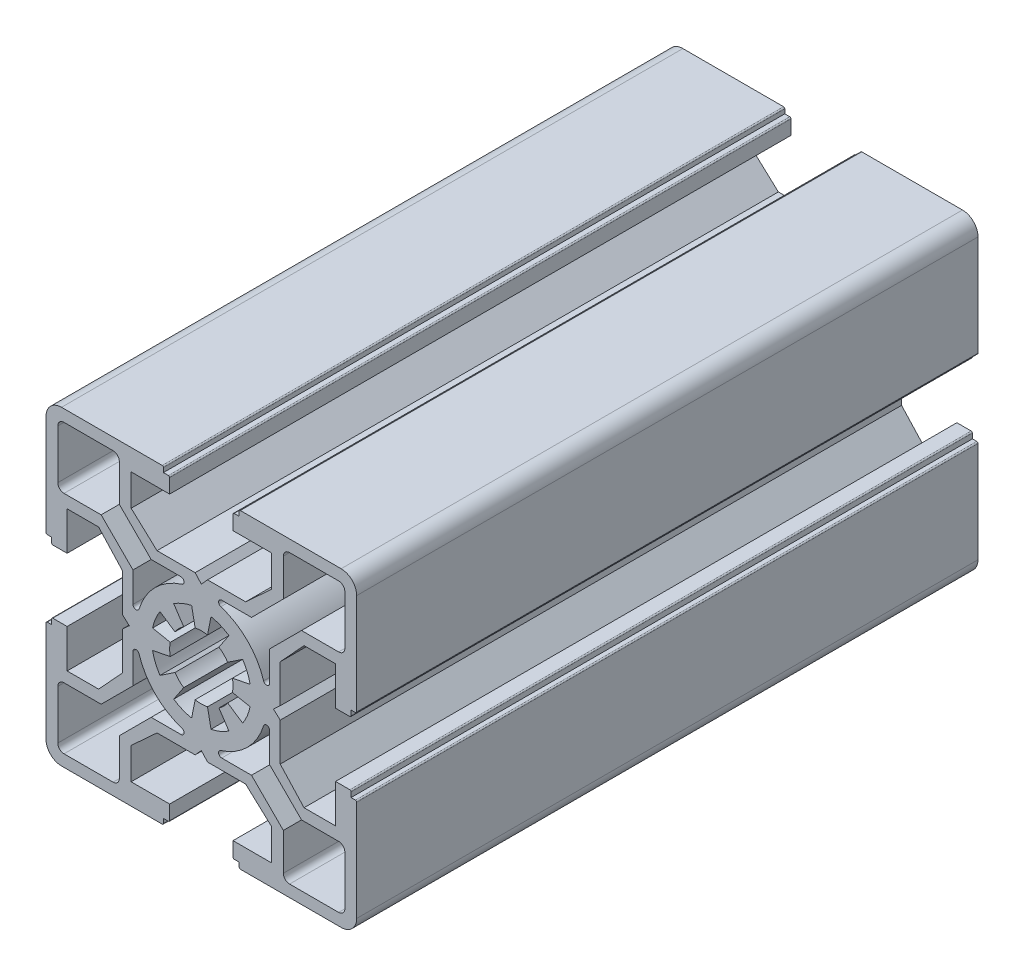
from build123d import *

# Parameters (mm, degrees)
EXTRUDE_1_DEPTH = 100


with BuildPart() as part:
    # 草图1 → 凸台-拉伸1 (new body)
    with BuildSketch(Plane.XY):
        with BuildLine():
            Line((-6.3, 25), (-22.5, 25))
            ThreePointArc((-22.5, 25), (-24.267766953, 24.267766953), (-25, 22.5))
            Line((-25, 22.5), (-25, 6.3))
            ThreePointArc((-25, 6.3), (-24.941421356, 6.158578644), (-24.8, 6.1))
            Line((-24.8, 6.1), (-24.1, 6.1))
            Line((-24.1, 6.1), (-24.1, 5.3))
            ThreePointArc((-24.1, 5.3), (-24.041421356, 5.158578644), (-23.9, 5.1))
            Line((-23.9, 5.1), (-21.6, 5.1))
            Line((-21.6, 5.1), (-21.6, 11.3))
            Line((-21.6, 11.3), (-16.53, 11.3))
            Line((-16.53, 11.3), (-12.7, 7.130151519))
            Line((-12.7, 7.130151519), (-12.7, 1))
            Line((-12.7, 1), (-11.6, 0))
            Line((-11.6, 0), (-12.7, -1))
            Line((-12.7, -1), (-12.7, -7.130151519))
            Line((-12.7, -7.130151519), (-16.53, -11.3))
            Line((-16.53, -11.3), (-21.6, -11.3))
            Line((-21.6, -11.3), (-21.6, -5.1))
            Line((-21.6, -5.1), (-23.9, -5.1))
            ThreePointArc((-23.9, -5.1), (-24.041421356, -5.158578644), (-24.1, -5.3))
            Line((-24.1, -5.3), (-24.1, -6.1))
            Line((-24.1, -6.1), (-24.8, -6.1))
            ThreePointArc((-24.8, -6.1), (-24.941421356, -6.158578644), (-25, -6.3))
            Line((-25, -6.3), (-25, -22.5))
            ThreePointArc((-25, -22.5), (-24.267766953, -24.267766953), (-22.5, -25))
            Line((-22.5, -25), (-6.3, -25))
            ThreePointArc((-6.3, -25), (-6.158578644, -24.941421356), (-6.1, -24.8))
            Line((-6.1, -24.8), (-6.1, -24.1))
            Line((-6.1, -24.1), (-5.3, -24.1))
            ThreePointArc((-5.3, -24.1), (-5.158578644, -24.041421356), (-5.1, -23.9))
            Line((-5.1, -23.9), (-5.1, -21.6))
            Line((-5.1, -21.6), (-11.3, -21.6))
            Line((-11.3, -21.6), (-11.3, -16.53))
            Line((-11.3, -16.53), (-7.130151519, -12.7))
            Line((-7.130151519, -12.7), (-1, -12.7))
            Line((-1, -12.7), (0, -11.6))
            Line((0, -11.6), (1, -12.7))
            Line((1, -12.7), (7.130151519, -12.7))
            Line((7.130151519, -12.7), (11.3, -16.53))
            Line((11.3, -16.53), (11.3, -21.6))
            Line((11.3, -21.6), (5.1, -21.6))
            Line((5.1, -21.6), (5.1, -23.9))
            ThreePointArc((5.1, -23.9), (5.158578644, -24.041421356), (5.3, -24.1))
            Line((5.3, -24.1), (6.1, -24.1))
            Line((6.1, -24.1), (6.1, -24.8))
            ThreePointArc((6.1, -24.8), (6.158578644, -24.941421356), (6.3, -25))
            Line((6.3, -25), (22.5, -25))
            ThreePointArc((22.5, -25), (24.267766953, -24.267766953), (25, -22.5))
            Line((25, -22.5), (25, -6.3))
            ThreePointArc((25, -6.3), (24.941421356, -6.158578644), (24.8, -6.1))
            Line((24.8, -6.1), (24.1, -6.1))
            Line((24.1, -6.1), (24.1, -5.3))
            ThreePointArc((24.1, -5.3), (24.041421356, -5.158578644), (23.9, -5.1))
            Line((23.9, -5.1), (21.6, -5.1))
            Line((21.6, -5.1), (21.6, -11.3))
            Line((21.6, -11.3), (16.53, -11.3))
            Line((16.53, -11.3), (12.7, -7.130151519))
            Line((12.7, -7.130151519), (12.7, -1))
            Line((12.7, -1), (11.6, 0))
            Line((11.6, 0), (12.7, 1))
            Line((12.7, 1), (12.7, 7.130151519))
            Line((12.7, 7.130151519), (16.53, 11.3))
            Line((16.53, 11.3), (21.6, 11.3))
            Line((21.6, 11.3), (21.6, 5.1))
            Line((21.6, 5.1), (23.9, 5.1))
            ThreePointArc((23.9, 5.1), (24.041421356, 5.158578644), (24.1, 5.3))
            Line((24.1, 5.3), (24.1, 6.1))
            Line((24.1, 6.1), (24.8, 6.1))
            ThreePointArc((24.8, 6.1), (24.941421356, 6.158578644), (25, 6.3))
            Line((25, 6.3), (25, 22.5))
            ThreePointArc((25, 22.5), (24.267766953, 24.267766953), (22.5, 25))
            Line((22.5, 25), (6.3, 25))
            ThreePointArc((6.3, 25), (6.158578644, 24.941421356), (6.1, 24.8))
            Line((6.1, 24.8), (6.1, 24.1))
            Line((6.1, 24.1), (5.3, 24.1))
            ThreePointArc((5.3, 24.1), (5.158578644, 24.041421356), (5.1, 23.9))
            Line((5.1, 23.9), (5.1, 21.6))
            Line((5.1, 21.6), (11.3, 21.6))
            Line((11.3, 21.6), (11.3, 16.53))
            Line((11.3, 16.53), (7.130151519, 12.7))
            Line((7.130151519, 12.7), (1, 12.7))
            Line((1, 12.7), (0, 11.6))
            Line((0, 11.6), (-1, 12.7))
            Line((-1, 12.7), (-7.130151519, 12.7))
            Line((-7.130151519, 12.7), (-11.3, 16.53))
            Line((-11.3, 16.53), (-11.3, 21.6))
            Line((-11.3, 21.6), (-5.1, 21.6))
            Line((-5.1, 21.6), (-5.1, 23.9))
            ThreePointArc((-5.1, 23.9), (-5.158578644, 24.041421356), (-5.3, 24.1))
            Line((-5.3, 24.1), (-6.1, 24.1))
            Line((-6.1, 24.1), (-6.1, 24.8))
            ThreePointArc((-6.1, 24.8), (-6.158578644, 24.941421356), (-6.3, 25))
        make_face()
        with BuildLine():
            Line((2.833408188, 4.240495023), (4.444561864, 6.651756898))
            ThreePointArc((4.444561864, 6.651756898), (3.061467459, 7.39103626), (1.560722576, 7.846282243))
            Line((1.560722576, 7.846282243), (0.994960642, 5.00200493))
            ThreePointArc((0.994960642, 5.00200493), (0, 5.1), (-0.994960642, 5.00200493))
            Line((-0.994960642, 5.00200493), (-1.560722576, 7.846282243))
            ThreePointArc((-1.560722576, 7.846282243), (-3.061467459, 7.39103626), (-4.444561864, 6.651756898))
            Line((-4.444561864, 6.651756898), (-2.833408188, 4.240495023))
            ThreePointArc((-2.833408188, 4.240495023), (-3.606244584, 3.606244584), (-4.240495023, 2.833408188))
            Line((-4.240495023, 2.833408188), (-6.651756898, 4.444561864))
            ThreePointArc((-6.651756898, 4.444561864), (-7.39103626, 3.061467459), (-7.846282243, 1.560722576))
            Line((-7.846282243, 1.560722576), (-5.00200493, 0.994960642))
            ThreePointArc((-5.00200493, 0.994960642), (-5.1, 0), (-5.00200493, -0.994960642))
            Line((-5.00200493, -0.994960642), (-7.846282243, -1.560722576))
            ThreePointArc((-7.846282243, -1.560722576), (-7.39103626, -3.061467459), (-6.651756898, -4.444561864))
            Line((-6.651756898, -4.444561864), (-4.240495023, -2.833408188))
            ThreePointArc((-4.240495023, -2.833408188), (-3.606244584, -3.606244584), (-2.833408188, -4.240495023))
            Line((-2.833408188, -4.240495023), (-4.444561864, -6.651756898))
            ThreePointArc((-4.444561864, -6.651756898), (-3.061467459, -7.39103626), (-1.560722576, -7.846282243))
            Line((-1.560722576, -7.846282243), (-0.994960642, -5.00200493))
            ThreePointArc((-0.994960642, -5.00200493), (0, -5.1), (0.994960642, -5.00200493))
            Line((0.994960642, -5.00200493), (1.560722576, -7.846282243))
            ThreePointArc((1.560722576, -7.846282243), (3.061467459, -7.39103626), (4.444561864, -6.651756898))
            Line((4.444561864, -6.651756898), (2.833408188, -4.240495023))
            ThreePointArc((2.833408188, -4.240495023), (3.606244584, -3.606244584), (4.240495023, -2.833408188))
            Line((4.240495023, -2.833408188), (6.651756898, -4.444561864))
            ThreePointArc((6.651756898, -4.444561864), (7.39103626, -3.061467459), (7.846282243, -1.560722576))
            Line((7.846282243, -1.560722576), (5.00200493, -0.994960642))
            ThreePointArc((5.00200493, -0.994960642), (5.1, 0), (5.00200493, 0.994960642))
            Line((5.00200493, 0.994960642), (7.846282243, 1.560722576))
            ThreePointArc((7.846282243, 1.560722576), (7.39103626, 3.061467459), (6.651756898, 4.444561864))
            Line((6.651756898, 4.444561864), (4.240495023, 2.833408188))
            ThreePointArc((4.240495023, 2.833408188), (3.606244584, 3.606244584), (2.833408188, 4.240495023))
        make_face(mode=Mode.SUBTRACT)
        with BuildLine():
            Line((3.278719262, -11), (8.075735931, -11))
            Line((8.075735931, -11), (13.2, -16.124264069))
            Line((13.2, -16.124264069), (13.2, -22.1))
            ThreePointArc((13.2, -22.1), (13.492893219, -22.807106781), (14.2, -23.1))
            Line((14.2, -23.1), (22.1, -23.1))
            ThreePointArc((22.1, -23.1), (22.807106781, -22.807106781), (23.1, -22.1))
            Line((23.1, -22.1), (23.1, -14.2))
            ThreePointArc((23.1, -14.2), (22.807106781, -13.492893219), (22.1, -13.2))
            Line((22.1, -13.2), (16.124264069, -13.2))
            Line((16.124264069, -13.2), (11, -8.075735931))
            Line((11, -8.075735931), (11, -3.278719262))
            ThreePointArc((11, -3.278719262), (10.575377836, -2.784433736), (10.022727273, -3.129686568))
            ThreePointArc((10.022727273, -3.129686568), (7.424621202, -7.424621202), (3.129686568, -10.022727273))
            ThreePointArc((3.129686568, -10.022727273), (2.784433736, -10.575377836), (3.278719262, -11))
        make_face(mode=Mode.SUBTRACT)
        with BuildLine():
            Line((-8.075735931, 11), (-13.2, 16.124264069))
            Line((-13.2, 16.124264069), (-13.2, 22.1))
            ThreePointArc((-13.2, 22.1), (-13.492893219, 22.807106781), (-14.2, 23.1))
            Line((-14.2, 23.1), (-22.1, 23.1))
            ThreePointArc((-22.1, 23.1), (-22.807106781, 22.807106781), (-23.1, 22.1))
            Line((-23.1, 22.1), (-23.1, 14.2))
            ThreePointArc((-23.1, 14.2), (-22.807106781, 13.492893219), (-22.1, 13.2))
            Line((-22.1, 13.2), (-16.124264069, 13.2))
            Line((-16.124264069, 13.2), (-11, 8.075735931))
            Line((-11, 8.075735931), (-11, 3.278719262))
            ThreePointArc((-11, 3.278719262), (-10.575377836, 2.784433736), (-10.022727273, 3.129686568))
            ThreePointArc((-10.022727273, 3.129686568), (-7.424621202, 7.424621202), (-3.129686568, 10.022727273))
            ThreePointArc((-3.129686568, 10.022727273), (-2.784433736, 10.575377836), (-3.278719262, 11))
            Line((-3.278719262, 11), (-8.075735931, 11))
        make_face(mode=Mode.SUBTRACT)
        with BuildLine():
            Line((13.2, 22.1), (13.2, 16.124264069))
            Line((13.2, 16.124264069), (8.075735931, 11))
            Line((8.075735931, 11), (3.278719262, 11))
            ThreePointArc((3.278719262, 11), (2.784433736, 10.575377836), (3.129686568, 10.022727273))
            ThreePointArc((3.129686568, 10.022727273), (7.424621202, 7.424621202), (10.022727273, 3.129686568))
            ThreePointArc((10.022727273, 3.129686568), (10.575377836, 2.784433736), (11, 3.278719262))
            Line((11, 3.278719262), (11, 8.075735931))
            Line((11, 8.075735931), (16.124264069, 13.2))
            Line((16.124264069, 13.2), (22.1, 13.2))
            ThreePointArc((22.1, 13.2), (22.807106781, 13.492893219), (23.1, 14.2))
            Line((23.1, 14.2), (23.1, 22.1))
            ThreePointArc((23.1, 22.1), (22.807106781, 22.807106781), (22.1, 23.1))
            Line((22.1, 23.1), (14.2, 23.1))
            ThreePointArc((14.2, 23.1), (13.492893219, 22.807106781), (13.2, 22.1))
        make_face(mode=Mode.SUBTRACT)
        with BuildLine():
            Line((-16.124264069, -13.2), (-22.1, -13.2))
            ThreePointArc((-22.1, -13.2), (-22.807106781, -13.492893219), (-23.1, -14.2))
            Line((-23.1, -14.2), (-23.1, -22.1))
            ThreePointArc((-23.1, -22.1), (-22.807106781, -22.807106781), (-22.1, -23.1))
            Line((-22.1, -23.1), (-14.2, -23.1))
            ThreePointArc((-14.2, -23.1), (-13.492893219, -22.807106781), (-13.2, -22.1))
            Line((-13.2, -22.1), (-13.2, -16.124264069))
            Line((-13.2, -16.124264069), (-8.075735931, -11))
            Line((-8.075735931, -11), (-3.278719262, -11))
            ThreePointArc((-3.278719262, -11), (-2.784433736, -10.575377836), (-3.129686568, -10.022727273))
            ThreePointArc((-3.129686568, -10.022727273), (-7.424621202, -7.424621202), (-10.022727273, -3.129686568))
            ThreePointArc((-10.022727273, -3.129686568), (-10.575377836, -2.784433736), (-11, -3.278719262))
            Line((-11, -3.278719262), (-11, -8.075735931))
            Line((-11, -8.075735931), (-16.124264069, -13.2))
        make_face(mode=Mode.SUBTRACT)
    extrude(amount=EXTRUDE_1_DEPTH)


solid = part.part
